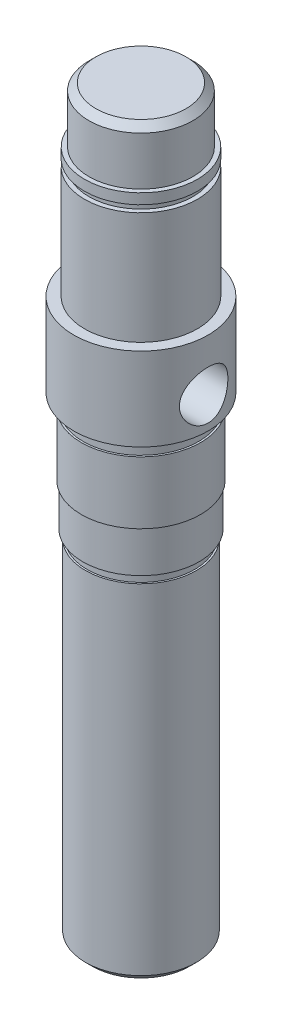
from build123d import *

# Parameters (mm, degrees)
ENL_V_START             = -5.5
ESQUISSE2_W             = 11.618950038
ESQUISSE2_H             = 44.4
ENL_V_MAT_EXTRU_1_DEPTH = 103.375761874
ENL_V_MAT_EXTRU_2_DEPTH = 108.875761874
ESQUISSE6_R             = 3.5
ENL_V_MAT_EXTRU_3_DEPTH = 78
CHANFREIN1_SIZE         = 1


with BuildPart() as part:
    # Esquisse1 → Révolution1 (revolve)
    with BuildSketch(Plane.XY, mode=Mode.PRIVATE) as r_volution1_sk:
        Polygon((0, 0), (-7, 0), (-8, 1), (-8, 50), (-7.75, 50), (-7.75, 51.3), (-8.4, 51.3), (-8.4, 57.3), (-8.6, 57.3), (-8.6, 66.3), (-8.33, 66.3), (-8.33, 68.3), (-9.7, 68.3), (-9.7, 80.3), (-8.15, 80.3), (-8.15, 96.5), (-7.5, 96.5), (-7.5, 97.5), (-8.15, 97.5), (-8.15, 99), (-7.5, 99), (-7.5, 106), (-6.5, 107), (0, 107), align=None)
    revolve(r_volution1_sk.sketch.rotate(Axis((0, 107, 0), (0, -1, 0)), 270), axis=Axis((0, 107, 0), (0, -1, 0)))

    # Esquisse2 → Enlèv. mat.-Extru.1 (cut, through all)
    with BuildSketch(Plane.XY.offset(ENL_V_START)):
        with Locations((0, 24.9)):
            Rectangle(ESQUISSE2_W, ESQUISSE2_H)
    extrude(amount=-ENL_V_MAT_EXTRU_1_DEPTH, mode=Mode.SUBTRACT)

    # Esquisse5 → Enlèv. mat.-Extru.2 (cut, through all)
    with BuildSketch(Plane(origin=(0, 0, 0), x_dir=(0, 0, -1), z_dir=(1, 0, 0))):
        with BuildLine():
            ThreePointArc((0, 76.3), (-3.5, 72.8), (0, 69.3))
            ThreePointArc((0, 69.3), (3.5, 72.8), (0, 76.3))
        make_face()
    extrude(amount=ENL_V_MAT_EXTRU_2_DEPTH, mode=Mode.SUBTRACT)

    # Esquisse6 → Enlèv. mat.-Extru.3 (cut)
    with BuildSketch(Plane.XZ):
        with Locations(Location((0, 0, 0), (0, 0, 270))):
            Circle(ESQUISSE6_R)
    extrude(amount=-ENL_V_MAT_EXTRU_3_DEPTH, mode=Mode.SUBTRACT)

    # Chanfrein1
    chanfrein1_edges = [part.edges().sort_by_distance(p)[0] for p in [
        (0, 0, 3.5),
    ]]
    chamfer(chanfrein1_edges, length=CHANFREIN1_SIZE)


solid = part.part
